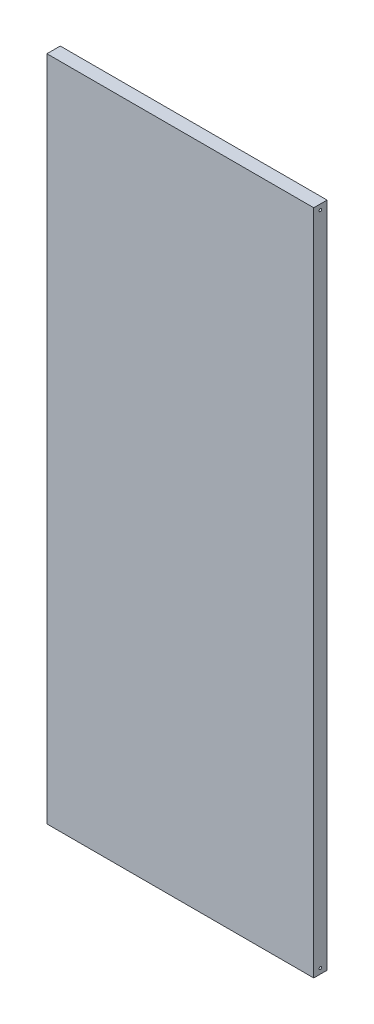
from build123d import *

# Parameters (mm, degrees)
SKETCH1_W           = 5.08
SKETCH1_H           = 12.7
BOSS_EXTRUDE1_DEPTH = 0.254
SKETCH2_R           = 0.0254
CUT_EXTRUDE1_DEPTH  = 9.185590892


with BuildPart() as part:
    # Sketch1 → Boss-Extrude1 (new body)
    with BuildSketch(Plane.XY):
        with Locations((-20.5105, -0.0635)):
            Rectangle(SKETCH1_W, SKETCH1_H)
    extrude(amount=BOSS_EXTRUDE1_DEPTH)

    # Sketch2 → Cut-Extrude1 (cut, through all)
    with BuildSketch(Plane(origin=(-17.9705, 0, 0), x_dir=(0, 0, -1), z_dir=(1, 0, 0))):
        with Locations(Location((-0.127, 6.1849, 0), (0, 0, 90))):
            Circle(SKETCH2_R)
        with Locations(Location((-0.127, -6.3119, 0), (0, 0, 90))):
            Circle(SKETCH2_R)
    extrude(amount=-CUT_EXTRUDE1_DEPTH, mode=Mode.SUBTRACT)


solid = part.part
